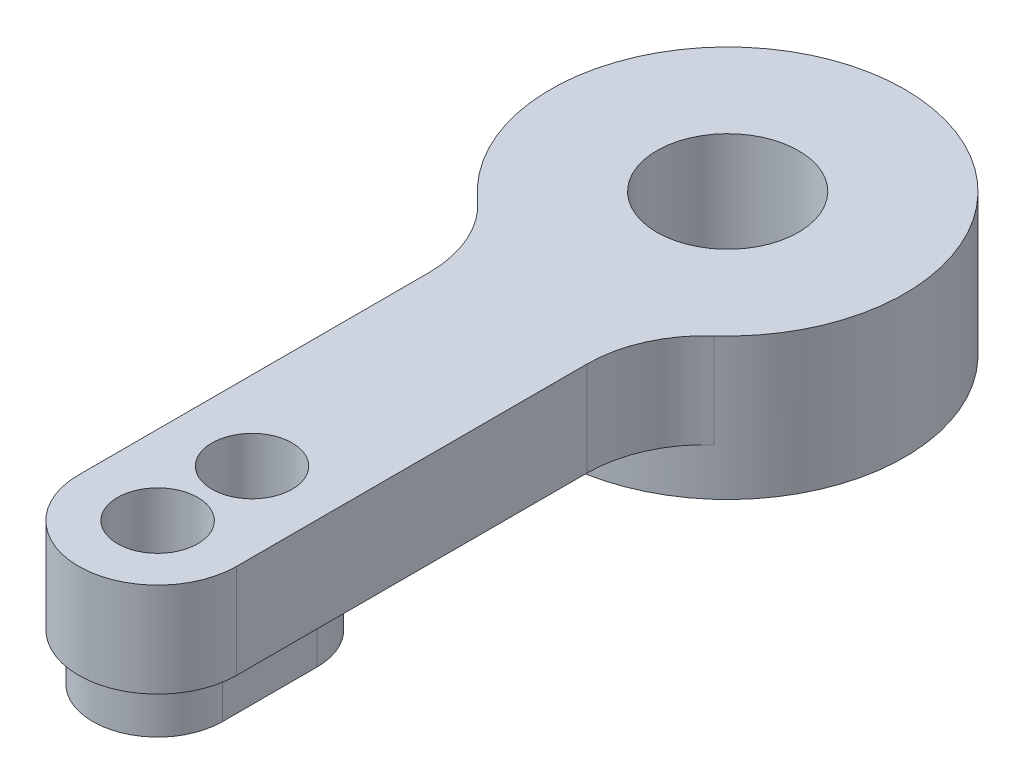
from build123d import *
from build123d.topology import SkipClean

# Parameters (mm, degrees)
ESQUISSE1_R             = 3
BOSS_EXTRU_1_DEPTH      = 6
D_GAGEMENT_M31_D        = 3.4
ENL_V_MAT_EXTRU_1_DEPTH = 2
CONG_2_R                = 5


with BuildPart() as part:
    # Esquisse1 → Boss.-Extru.1 (new body)
    with BuildSketch(Plane(origin=(0, 0, 0), x_dir=(1, 0, 0), z_dir=(0, 1, 0))):
        with BuildLine():
            Line((-3.35, -24.15), (-3.35, -6.710253348))
            ThreePointArc((-3.35, -6.710253348), (0, 7.5), (3.35, -6.710253348))
            Line((3.35, -6.710253348), (3.35, -24.15))
            ThreePointArc((3.35, -24.15), (0, -27.5), (-3.35, -24.15))
        make_face()
        with Locations(Location((0, 0, 0), (0, 0, 270))):
            Circle(ESQUISSE1_R, mode=Mode.SUBTRACT)
    extrude(amount=BOSS_EXTRU_1_DEPTH)

    # Dégagement M31 (through all)
    with Locations(Plane(origin=(0, 0, 0), x_dir=(-1, 0, 0), z_dir=(0, -1, 0))):
        with Locations((0, -24.15), (0, -20.15)):
            Hole(D_GAGEMENT_M31_D / 2)

    # Esquisse6 → Enlèv. mat.-Extru.1 (cut)
    with SkipClean():  # the faces are left unmerged after this step: merging them gives an invalid solid
        with BuildSketch(Plane.XZ):
            with BuildLine():
                Line((-3.35, 24.15), (-3.35, 6.710253348))
                ThreePointArc((-3.35, 6.710253348), (0, 7.5), (3.35, 6.710253348))
                Line((3.35, 6.710253348), (3.35, 24.15))
                ThreePointArc((3.35, 24.15), (0, 27.5), (-3.35, 24.15))
            make_face()
            with BuildLine():
                Line((2.75, 24.15), (2.75, 20.15))
                ThreePointArc((2.75, 20.15), (0, 17.4), (-2.75, 20.15))
                Line((-2.75, 20.15), (-2.75, 24.15))
                ThreePointArc((-2.75, 24.15), (0, 26.9), (2.75, 24.15))
            make_face(mode=Mode.SUBTRACT)
        extrude(amount=-ENL_V_MAT_EXTRU_1_DEPTH, mode=Mode.SUBTRACT)

    # Congé2
    cong_2_edges = [part.edges().sort_by_distance(p)[0] for p in [
        (-3.35, 4, 6.710253348),
        (3.35, 4, 6.710253348),
    ]]
    fillet(cong_2_edges, radius=CONG_2_R)


solid = part.part
